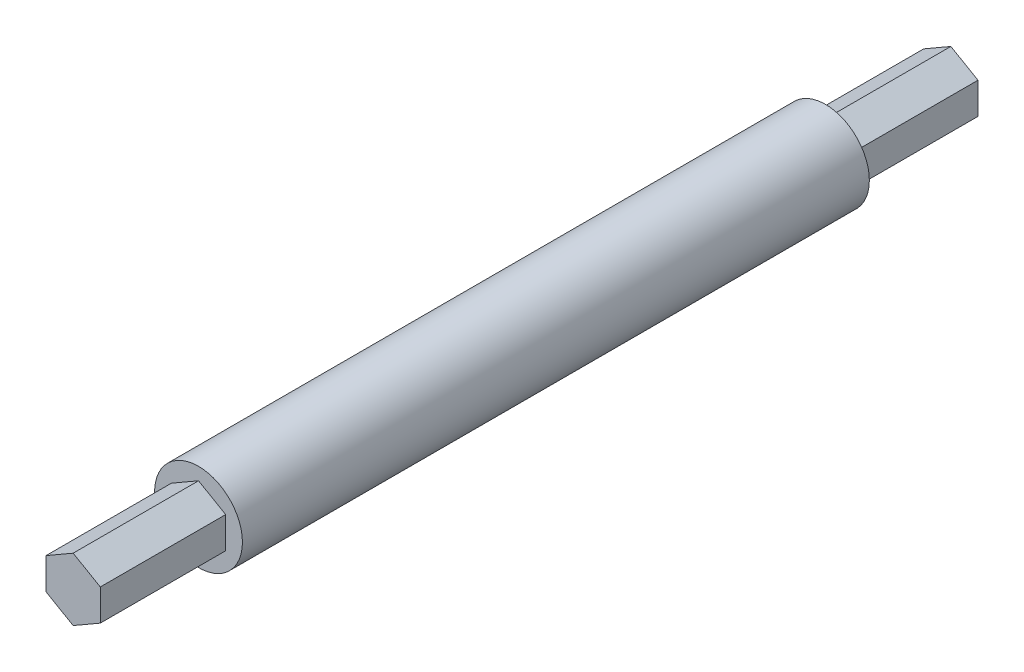
from build123d import *

# Parameters (mm, degrees)
SKETCH1_R           = 7
BOSS_EXTRUDE1_DEPTH = 100
BOSS_EXTRUDE2_DEPTH = 20
BOSS_EXTRUDE3_DEPTH = 20


with BuildPart() as part:
    # Sketch1 → Boss-Extrude1 (new body)
    with BuildSketch(Plane.XY):
        Circle(SKETCH1_R)
    extrude(amount=-BOSS_EXTRUDE1_DEPTH)

    # Sketch2 → Boss-Extrude2 (add)
    with BuildSketch(Plane.XY):
        Polygon((0, 5), (-4.330127019, 2.5), (-4.330127019, -2.5), (0, -5), (4.330127019, -2.5), (4.330127019, 2.5), align=None)
    extrude(amount=BOSS_EXTRUDE2_DEPTH)

    # Sketch3 → Boss-Extrude3 (add)
    with BuildSketch(Plane(origin=(0, 0, -100), x_dir=(-1, 0, 0), z_dir=(0, 0, -1))):
        Polygon((0, 5), (-4.330127019, 2.5), (-4.330127019, -2.5), (0, -5), (4.330127019, -2.5), (4.330127019, 2.5), align=None)
    extrude(amount=BOSS_EXTRUDE3_DEPTH)


solid = part.part
